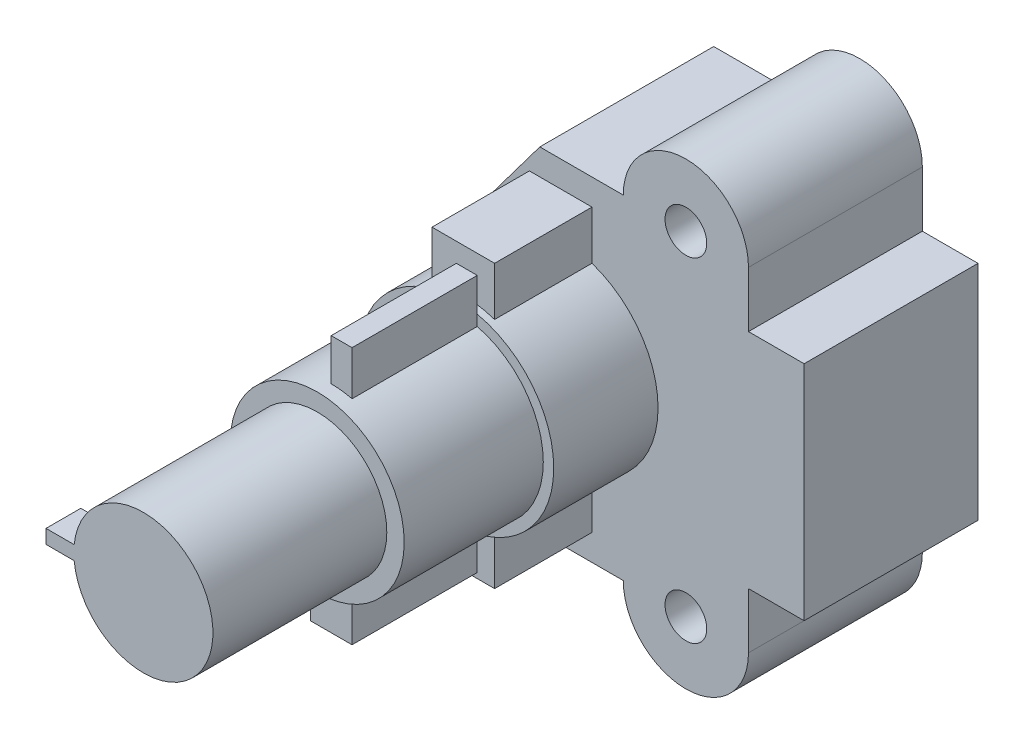
from build123d import *

# Parameters (mm, degrees)
SKETCH1_R                = 3
BOSS_EXTRUDE1_DEPTH      = 25
BOSS_EXTRUDE2_DEPTH      = 15
BOSS_EXTRUDE3_DEPTH      = 14
BOSS_EXTRUDE4_DEPTH      = 20
BOSS_EXTRUDE5_DEPTH      = 18
SKETCH5_R                = 10
BOSS_EXTRUDE6_DEPTH      = 25
BOSS_EXTRUDE7_REACH      = 103.681
BOSS_EXTRUDE7_END_RADIUS = 10
BOSS_EXTRUDE8_DEPTH      = 1
SKETCH7_4_W              = 5
SKETCH7_4_H              = 2
BOSS_EXTRUDE9_DEPTH      = 4
SKETCH10_R               = 8
CUT_EXTRUDE1_DEPTH       = 15


with BuildPart() as part:
    # Sketch1 → Boss-Extrude1 (new body)
    with BuildSketch(Plane(origin=(0, 0, 0), x_dir=(0, 1, 0), z_dir=(0, 0, 1))):
        with BuildLine():
            Line((-24, 21), (-24, 9))
            ThreePointArc((-24, 9), (-33, 0), (-24, -9))
            Line((-24, -9), (-16, -9))
            Line((-16, -9), (-16, -17))
            Line((-16, -17), (16, -17))
            Line((16, -17), (16, -9))
            Line((16, -9), (24, -9))
            ThreePointArc((24, -9), (33, 0), (24, 9))
            Line((24, 9), (24, 21))
            Line((24, 21), (8, 33))
            Line((8, 33), (-8, 33))
            Line((-8, 33), (-24, 21))
        make_face()
        with Locations((-24, 0)):
            Circle(SKETCH1_R, mode=Mode.SUBTRACT)
        with Locations((24, 0)):
            Circle(SKETCH1_R, mode=Mode.SUBTRACT)
    extrude(amount=-BOSS_EXTRUDE1_DEPTH)

    # Sketch2 → Boss-Extrude2 (add)
    with BuildSketch(Plane.XY):
        with BuildLine():
            ThreePointArc((-13.5, -13.257073584), (-4, 0), (-13.5, 13.257073584))
            ThreePointArc((-13.5, 13.257073584), (-18, 14), (-22.5, 13.257073584))
            ThreePointArc((-22.5, 13.257073584), (-32, 0), (-22.5, -13.257073584))
            ThreePointArc((-22.5, -13.257073584), (-18, -14), (-13.5, -13.257073584))
        make_face()
    extrude(amount=BOSS_EXTRUDE2_DEPTH)

    # Sketch2<3> → Boss-Extrude3 (add)
    with BuildSketch(Plane.XY):
        with BuildLine():
            Line((-13.5, 13.257073584), (-13.5, 20.257073584))
            Line((-13.5, 20.257073584), (-22.5, 20.257073584))
            Line((-22.5, 20.257073584), (-22.5, 13.257073584))
            ThreePointArc((-22.5, 13.257073584), (-18, 14), (-13.5, 13.257073584))
        make_face()
        with BuildLine():
            Line((-13.5, -20.257073584), (-13.5, -13.257073584))
            ThreePointArc((-13.5, -13.257073584), (-18, -14), (-22.5, -13.257073584))
            Line((-22.5, -13.257073584), (-22.5, -20.257073584))
            Line((-22.5, -20.257073584), (-13.5, -20.257073584))
        make_face()
    extrude(amount=BOSS_EXTRUDE3_DEPTH)

    # Sketch3 → Boss-Extrude4 (add)
    with BuildSketch(Plane.XY.offset(15)):
        with BuildLine():
            ThreePointArc((-5.5, 0), (-8.157490157, 7.705517504), (-15, 12.1346611))
            ThreePointArc((-15, 12.1346611), (-18, 12.5), (-21, 12.1346611))
            ThreePointArc((-21, 12.1346611), (-27.842509843, 7.705517504), (-30.5, 0))
            ThreePointArc((-30.5, 0), (-27.842509843, -7.705517504), (-21, -12.1346611))
            ThreePointArc((-21, -12.1346611), (-18, -12.5), (-15, -12.1346611))
            ThreePointArc((-15, -12.1346611), (-8.157490157, -7.705517504), (-5.5, 0))
        make_face()
    extrude(amount=BOSS_EXTRUDE4_DEPTH)

    # Sketch3<3> → Boss-Extrude5 (add)
    with BuildSketch(Plane.XY.offset(15)):
        with BuildLine():
            Line((-18, 18.5), (-18, 12.5))
            ThreePointArc((-18, 12.5), (-16.488918226, 12.408329133), (-15, 12.1346611))
            Line((-15, 12.1346611), (-15, 18.5))
            Line((-15, 18.5), (-18, 18.5))
        make_face()
        with BuildLine():
            Line((-15, -18.5), (-15, -12.1346611))
            ThreePointArc((-15, -12.1346611), (-18, -12.5), (-21, -12.1346611))
            Line((-21, -12.1346611), (-21, -18.5))
            Line((-21, -18.5), (-15, -18.5))
        make_face()
    extrude(amount=BOSS_EXTRUDE5_DEPTH)

    # Sketch5 → Boss-Extrude6 (add)
    with BuildSketch(Plane.XY.offset(35)):
        with Locations((-18, 0)):
            Circle(SKETCH5_R)
    extrude(amount=BOSS_EXTRUDE6_DEPTH)

    # Boss-Extrude7: up to this cylinder (the profile starts outside it)
    boss_extrude7_end = Plane(origin=(-18, 0, 54.928571), z_dir=(0, 0, -1)) * Cylinder(BOSS_EXTRUDE7_END_RADIUS, 228.362, mode=Mode.PRIVATE)
    # Sketch7 → Boss-Extrude7 (add, up to the surface)
    with BuildSketch(Plane(origin=(-28, 0, 60), x_dir=(0, 0, 1), z_dir=(-1, 0, 0)), mode=Mode.PRIVATE) as boss_extrude7_sk1:
        Polygon((0, -1), (0, 1), (-5, 1), (-5, 3), (-8, 3), (-8, -3), (-5, -3), (-5, -1), align=None)
    boss_extrude7_tool1 = extrude(boss_extrude7_sk1.sketch, amount=-BOSS_EXTRUDE7_REACH, mode=Mode.PRIVATE) - boss_extrude7_end
    add(boss_extrude7_tool1.solids().sort_by_distance((-28, 0, 54.928571))[0])
    add(boss_extrude7_tool1.solids().sort_by_distance((-28, 0, 54.928571))[1])

    # Sketch7<2> → Boss-Extrude8 (add)
    with BuildSketch(Plane(origin=(-28, 0, 60), x_dir=(0, 0, 1), z_dir=(-1, 0, 0))):
        Polygon((-8, -3), (-5, -3), (-5, -1), (-5, 1), (-5, 3), (-8, 3), align=None)
    extrude(amount=BOSS_EXTRUDE8_DEPTH)

    # Sketch7<4> → Boss-Extrude9 (add)
    with BuildSketch(Plane(origin=(-28, 0, 60), x_dir=(0, 0, 1), z_dir=(-1, 0, 0))):
        with Locations((-2.5, 0)):
            Rectangle(SKETCH7_4_W, SKETCH7_4_H)
    extrude(amount=BOSS_EXTRUDE9_DEPTH)

    # Sketch10 → Cut-Extrude1 (cut)
    with BuildSketch(Plane(origin=(0, 0, -25), x_dir=(1, 0, 0), z_dir=(0, 0, -1))):
        with Locations((0, 24)):
            Circle(SKETCH10_R)
        with Locations((0, -24)):
            Circle(SKETCH10_R)
    extrude(amount=-CUT_EXTRUDE1_DEPTH, mode=Mode.SUBTRACT)


solid = part.part
